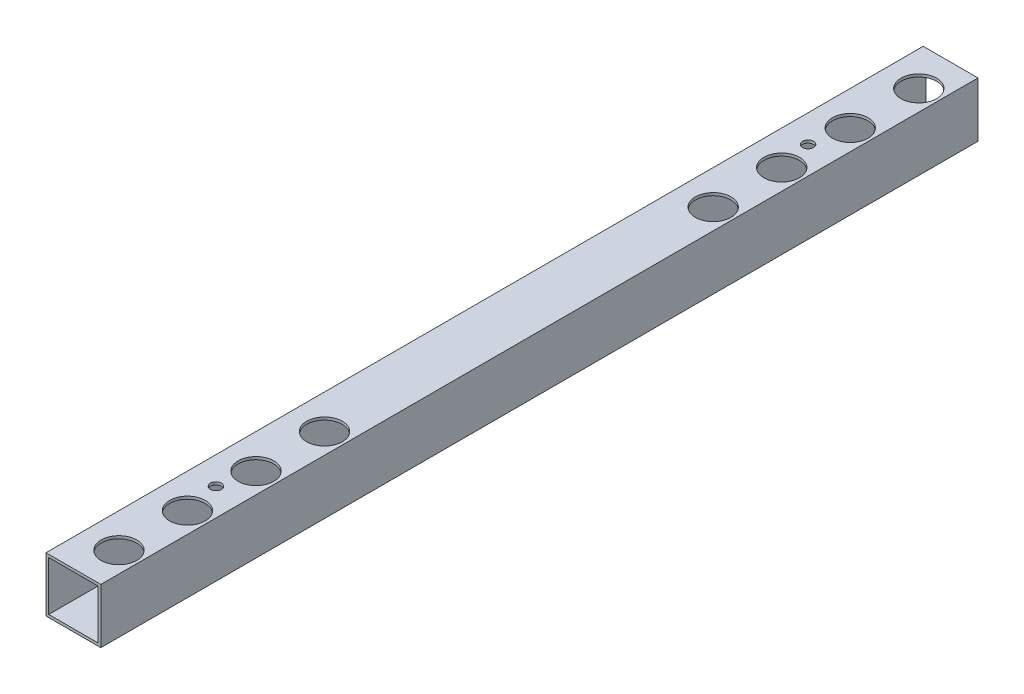
from build123d import *

# Parameters (mm, degrees)
SKETCH_1_W                  = 20
SKETCH_1_H                  = 20
SKETCH_1_W_2                = 18
SKETCH_1_H_2                = 18
EXTRUDE_1_DEPTH             = 160
HOLE_WIZARD_5_0_5_1_REACH   = 163.555
HOLE_WIZARD_5_0_5_1_BORE_R  = 2.5
PATTERN_LINEAR_1_COUNT      = 2
PATTERN_LINEAR_1_PITCH      = 50
MIRROR_1_COPY_1_REACH       = 163.555
MIRROR_1_COPY_1_SKETCH_R    = 2.5
HOLE_WIZARD_4_0_4_1_D       = 4
HOLE_WIZARD_13_0_13_1_D     = 13
HOLE_WIZARD_13_0_13_1_DEPTH = 1


with BuildPart() as part:
    # 草图1 → 凸台-拉伸1 (new, symmetric)
    with BuildSketch(Plane.XY):
        Rectangle(SKETCH_1_W, SKETCH_1_H)
        Rectangle(SKETCH_1_W_2, SKETCH_1_H_2, mode=Mode.SUBTRACT)
    extrude(amount=EXTRUDE_1_DEPTH, both=True)

    # Ø5.0 (5) 直径孔1 bore → Ø5.0 (5) 直径孔1 (cut, up to next)
    with BuildSketch(Plane(origin=(0, -10, 0), x_dir=(-1, 0, 0), z_dir=(0, -1, 0)), mode=Mode.PRIVATE) as hole_wizard_5_0_5_1_sk1:
        with Locations((-2.5, 145.9)):
            Circle(HOLE_WIZARD_5_0_5_1_BORE_R)
    hole_wizard_5_0_5_1_tool1 = extrude(hole_wizard_5_0_5_1_sk1.sketch, amount=-HOLE_WIZARD_5_0_5_1_REACH, mode=Mode.PRIVATE) & part.part
    # Ø5.0 (5) 直径孔1 bore → Ø5.0 (5) 直径孔1 (cut, up to next)
    with BuildSketch(Plane(origin=(0, -10, 0), x_dir=(-1, 0, 0), z_dir=(0, -1, 0)), mode=Mode.PRIVATE) as hole_wizard_5_0_5_1_sk2:
        with Locations((-2.5, 120.9)):
            Circle(HOLE_WIZARD_5_0_5_1_BORE_R)
    hole_wizard_5_0_5_1_tool2 = extrude(hole_wizard_5_0_5_1_sk2.sketch, amount=-HOLE_WIZARD_5_0_5_1_REACH, mode=Mode.PRIVATE) & part.part
    hole_wizard_5_0_5_1_1 = hole_wizard_5_0_5_1_tool1.solids().sort_by_distance((2.5, -10, -145.9))[0]
    add(hole_wizard_5_0_5_1_1, mode=Mode.SUBTRACT)
    hole_wizard_5_0_5_1_2 = hole_wizard_5_0_5_1_tool2.solids().sort_by_distance((2.5, -10, -120.9))[0]
    add(hole_wizard_5_0_5_1_2, mode=Mode.SUBTRACT)
    hole_wizard_5_0_5_1 = hole_wizard_5_0_5_1_1 + hole_wizard_5_0_5_1_2  # Ø5.0 (5) 直径孔1 as one shape, for the pattern or mirror that repeats it

    # 阵列(线性)1: Ø5.0 (5) 直径孔1 ×2
    with Locations(*[(0, 0, i * PATTERN_LINEAR_1_PITCH) for i in range(1, PATTERN_LINEAR_1_COUNT)]):
        add(hole_wizard_5_0_5_1, mode=Mode.SUBTRACT)

    # 镜向1: Ø5.0 (5) 直径孔1 across plane
    add(hole_wizard_5_0_5_1.mirror(Plane(origin=(0, 0, 0), x_dir=(1, 0, 0), z_dir=(0, 0, -1))), mode=Mode.SUBTRACT)

    # 镜向1 copy 1 sketch → 镜向1 copy 1 (cut, up to next)
    with BuildSketch(Plane(origin=(0, -10, -50), x_dir=(-1, 0, 0), z_dir=(0, -1, 0)), mode=Mode.PRIVATE) as mirror_1_copy_1_sk1:
        with Locations((-2.5, -145.9)):
            Circle(MIRROR_1_COPY_1_SKETCH_R)
    mirror_1_copy_1_tool1 = extrude(mirror_1_copy_1_sk1.sketch, amount=-MIRROR_1_COPY_1_REACH, mode=Mode.PRIVATE) & part.part
    # 镜向1 copy 1 sketch → 镜向1 copy 1 (cut, up to next)
    with BuildSketch(Plane(origin=(0, -10, -50), x_dir=(-1, 0, 0), z_dir=(0, -1, 0)), mode=Mode.PRIVATE) as mirror_1_copy_1_sk2:
        with Locations((-2.5, -120.9)):
            Circle(MIRROR_1_COPY_1_SKETCH_R)
    mirror_1_copy_1_tool2 = extrude(mirror_1_copy_1_sk2.sketch, amount=-MIRROR_1_COPY_1_REACH, mode=Mode.PRIVATE) & part.part
    add(mirror_1_copy_1_tool1.solids().sort_by_distance((2.5, -10, 95.9))[0], mode=Mode.SUBTRACT)
    add(mirror_1_copy_1_tool2.solids().sort_by_distance((2.5, -10, 70.9))[0], mode=Mode.SUBTRACT)

    # Ø4.0 (4) 直径孔1 (through all)
    with Locations(Plane(origin=(0, -10, 0), x_dir=(-1, 0, 0), z_dir=(0, -1, 0))):
        with Locations((0, -108)):
            hole_wizard_4_0_4_1 = Hole(HOLE_WIZARD_4_0_4_1_D / 2)

    # 镜向2: Ø4.0 (4) 直径孔1 across plane
    add(hole_wizard_4_0_4_1.mirror(Plane(origin=(0, 0, 0), x_dir=(1, 0, 0), z_dir=(0, 0, -1))), mode=Mode.SUBTRACT)

    # Ø13.0 (13) 直径孔1
    with Locations(Plane(origin=(0, 9, 0), x_dir=(-1, 0, 0), z_dir=(0, -1, 0))):
        with Locations((-2.5, 145.9), (-2.5, 120.9), (-2.5, 95.9), (-2.5, 70.9)):
            hole_wizard_13_0_13_1 = Hole(HOLE_WIZARD_13_0_13_1_D / 2, depth=HOLE_WIZARD_13_0_13_1_DEPTH)

    # 镜向3: Ø13.0 (13) 直径孔1 across plane
    add(hole_wizard_13_0_13_1.mirror(Plane(origin=(0, 0, 0), x_dir=(1, 0, 0), z_dir=(0, 0, -1))), mode=Mode.SUBTRACT)


solid = part.part
